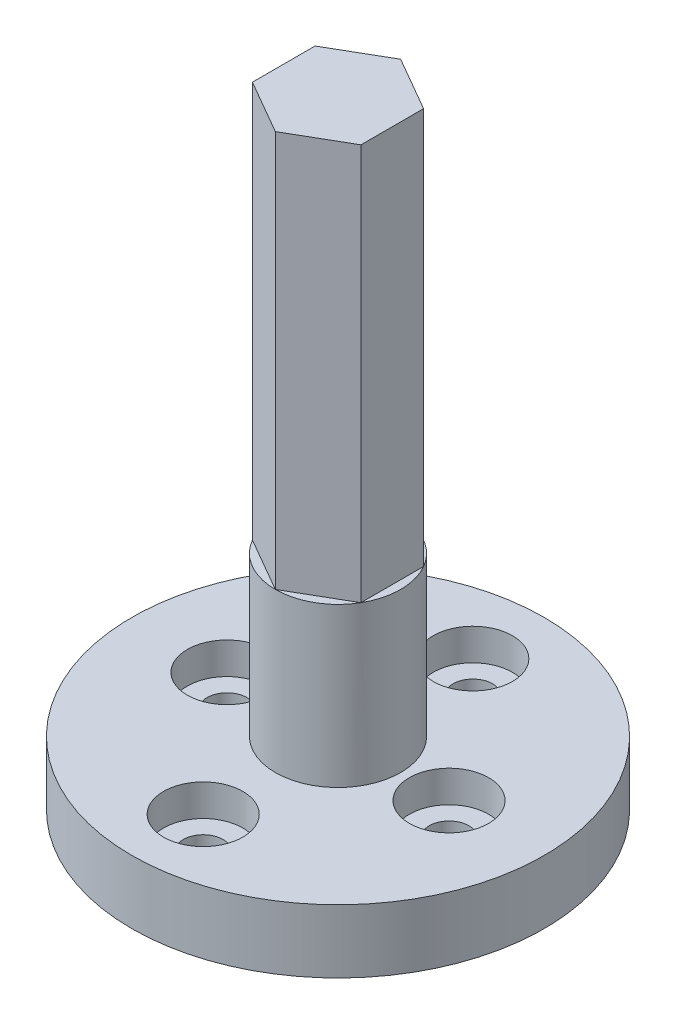
from build123d import *

# Parameters (mm, degrees)
CROQUIS3_R                 = 13
SALIENTE_EXTRUIR1_DEPTH    = 4
CROQUIS4_R                 = 3.95
SALIENTE_EXTRUIR2_DEPTH    = 35
CORTAR_EXTRUIR3_DEPTH      = 44.116122275
CORTAR_EXTRUIR3_DEPTH_BACK = 44.116122275
CROQUIS8_R                 = 1.25
CORTAR_EXTRUIR5_DEPTH      = 40.534794802
CORTAR_EXTRUIR5_DEPTH_BACK = 2
CROQUIS10_R                = 2.5
CROQUIS10_R_2              = 1.25
CROQUIS9_R                 = 1.625
CORTAR_EXTRUIR4_DEPTH      = 3
CROQUIS12_OUTSIDE_W        = 38.72
CROQUIS12_OUTSIDE_H        = 38.72
CORTAR_EXTRUIR7_DEPTH      = 25


with BuildPart() as part:
    # Croquis3 → Saliente-Extruir1 (new body)
    with BuildSketch(Plane(origin=(0, 0, 0), x_dir=(1, 0, 0), z_dir=(0, 1, 0))):
        with Locations(Location((0, 0, 0), (0, 0, 270))):
            Circle(CROQUIS3_R)
    extrude(amount=SALIENTE_EXTRUIR1_DEPTH)

    # Croquis4 → Saliente-Extruir2 (add)
    with BuildSketch(Plane(origin=(0, 4, 0), x_dir=(1, 0, 0), z_dir=(0, 1, 0))):
        with Locations(Location((0, 0, 0), (0, 0, 270))):
            Circle(CROQUIS4_R)
    extrude(amount=SALIENTE_EXTRUIR2_DEPTH)

    # Croquis8 → Cortar-Extruir3 (cut, two sides: drawn at the far end of the back side and taken through both)
    with BuildSketch(Plane.XZ.offset(-CORTAR_EXTRUIR3_DEPTH_BACK)):
        with Locations(Location((0, 8.5, 0), (0, 0, 90))):
            Circle(CROQUIS8_R)
        with Locations(Location((0, -8.5, 0), (0, 0, 90))):
            Circle(CROQUIS8_R)
        with Locations(Location((-7, 0, 0), (0, 0, 90))):
            Circle(CROQUIS8_R)
        with Locations(Location((7, 0, 0), (0, 0, 90))):
            Circle(CROQUIS8_R)
    extrude(amount=CORTAR_EXTRUIR3_DEPTH + CORTAR_EXTRUIR3_DEPTH_BACK, mode=Mode.SUBTRACT)

    # Croquis10 → Cortar-Extruir5 (cut, two sides: drawn at the far end of the back side and taken through both)
    # profile 1 of 4: a face of its own
    with BuildSketch(Plane(origin=(0, 4, 0), x_dir=(1, 0, 0), z_dir=(0, 1, 0)).offset(-CORTAR_EXTRUIR5_DEPTH_BACK)):
        with Locations(Location((0, 8.5, 0), (0, 0, 270))):
            Circle(CROQUIS10_R)
    # profile 2 of 4: a face of its own
    with BuildSketch(Plane(origin=(0, 4, 0), x_dir=(1, 0, 0), z_dir=(0, 1, 0)).offset(-CORTAR_EXTRUIR5_DEPTH_BACK)):
        with Locations(Location((0, -8.5, 0), (0, 0, 270))):
            Circle(CROQUIS10_R)
    # profile 3 of 4: a face of its own
    with BuildSketch(Plane(origin=(0, 4, 0), x_dir=(1, 0, 0), z_dir=(0, 1, 0)).offset(-CORTAR_EXTRUIR5_DEPTH_BACK)):
        with Locations(Location((-7, 0, 0), (0, 0, 270))):
            Circle(CROQUIS10_R)
        with Locations(Location((-7, 0, 0), (0, 0, 270))):
            Circle(CROQUIS10_R_2, mode=Mode.SUBTRACT)
    # profile 4 of 4: a face of its own
    with BuildSketch(Plane(origin=(0, 4, 0), x_dir=(1, 0, 0), z_dir=(0, 1, 0)).offset(-CORTAR_EXTRUIR5_DEPTH_BACK)):
        with Locations(Location((7, 0, 0), (0, 0, 270))):
            Circle(CROQUIS10_R)
        with Locations(Location((7, 0, 0), (0, 0, 270))):
            Circle(CROQUIS10_R_2, mode=Mode.SUBTRACT)
    extrude(amount=CORTAR_EXTRUIR5_DEPTH + CORTAR_EXTRUIR5_DEPTH_BACK, mode=Mode.SUBTRACT)

    # Croquis9 → Cortar-Extruir4 (cut)
    with BuildSketch(Plane(origin=(0, 0, 0), x_dir=(1, 0, 0), z_dir=(0, 1, 0))):
        with Locations(Location((0, 0, 0), (0, 0, 270))):
            Circle(CROQUIS9_R)
    extrude(amount=CORTAR_EXTRUIR4_DEPTH, mode=Mode.SUBTRACT)

    # Croquis12 outside → Cortar-Extruir7 (cut)
    with BuildSketch(Plane(origin=(0, 39, 0), x_dir=(1, 0, 0), z_dir=(0, 1, 0))):
        Rectangle(CROQUIS12_OUTSIDE_W, CROQUIS12_OUTSIDE_H)
        Polygon((0, 3.95), (-3.420800345, 1.975), (-3.420800345, -1.975), (0, -3.95), (3.420800345, -1.975), (3.420800345, 1.975), align=None, mode=Mode.SUBTRACT)
    extrude(amount=-CORTAR_EXTRUIR7_DEPTH, mode=Mode.SUBTRACT)


solid = part.part
